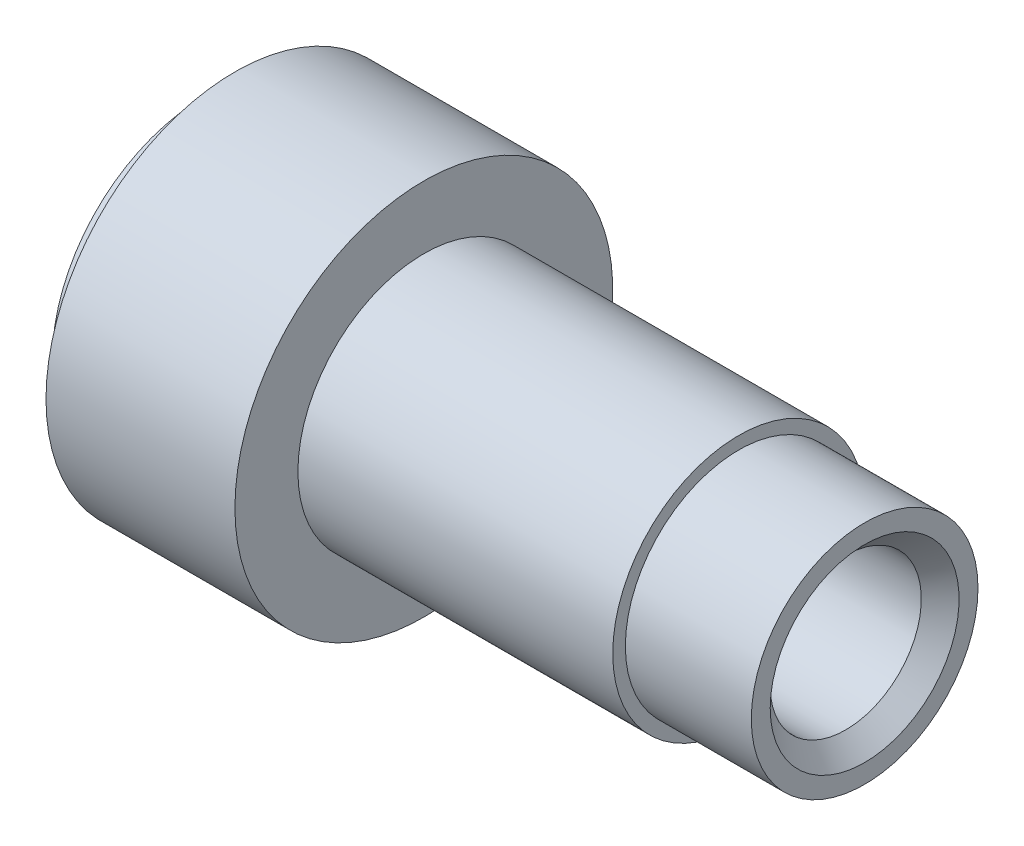
from build123d import *


with BuildPart() as part:
    # Skizze1 → Rotation1 (revolve)
    with BuildSketch(Plane.XY, mode=Mode.PRIVATE) as rotation1_sk:
        Polygon((3.482134942, -20), (13.482134942, -20), (13.482134942, -18), (33.482134942, -18), (33.482134942, -12), (105.482134942, -12), (108.482134942, -15), (108.482134942, -18), (88.482134942, -18), (88.482134942, -20), (38.482134942, -20), (38.482134942, -30), (8.482134942, -30), (8.482134942, -24), (3.482134942, -24), align=None)
    revolve(rotation1_sk.sketch.rotate(Axis((0, 0, 0), (1, 0, 0)), 270), axis=Axis((0, 0, 0), (1, 0, 0)))


solid = part.part
